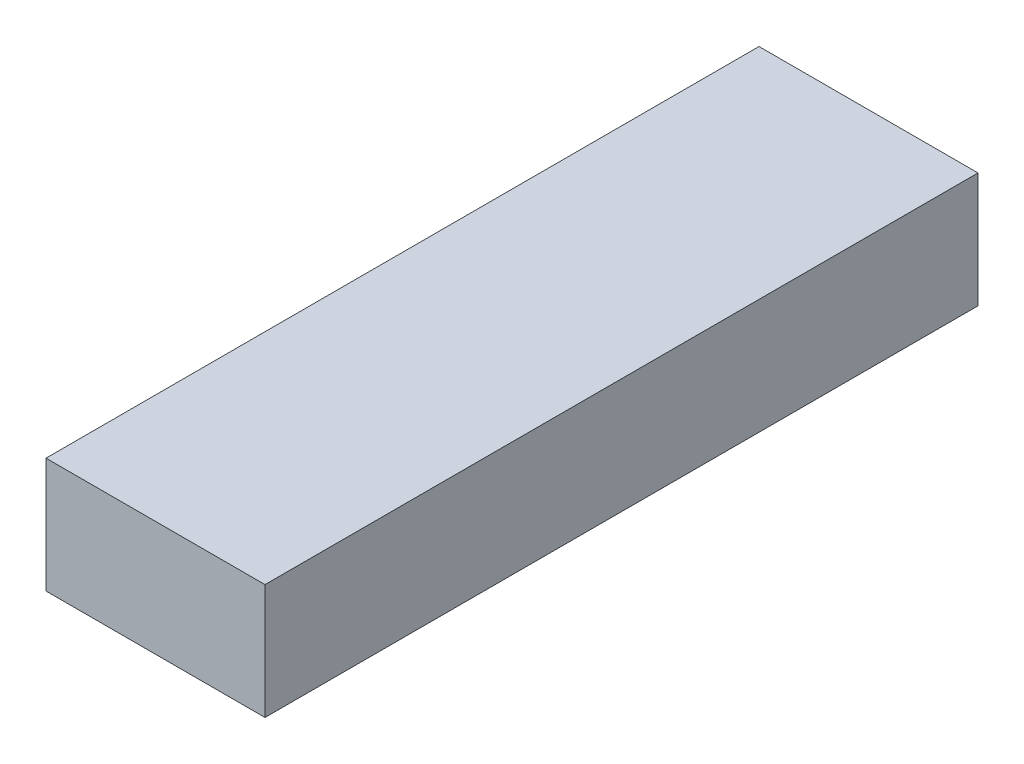
from build123d import *

# Parameters (mm, degrees)
SKETCH_1_W      = 43
SKETCH_1_H      = 140
EXTRUDE_1_DEPTH = 22.6


with BuildPart() as part:
    # 草图1 → 凸台-拉伸1 (new body)
    with BuildSketch(Plane(origin=(0, 0, 0), x_dir=(1, 0, 0), z_dir=(0, 1, 0))):
        Rectangle(SKETCH_1_W, SKETCH_1_H)
    extrude(amount=EXTRUDE_1_DEPTH)


solid = part.part
